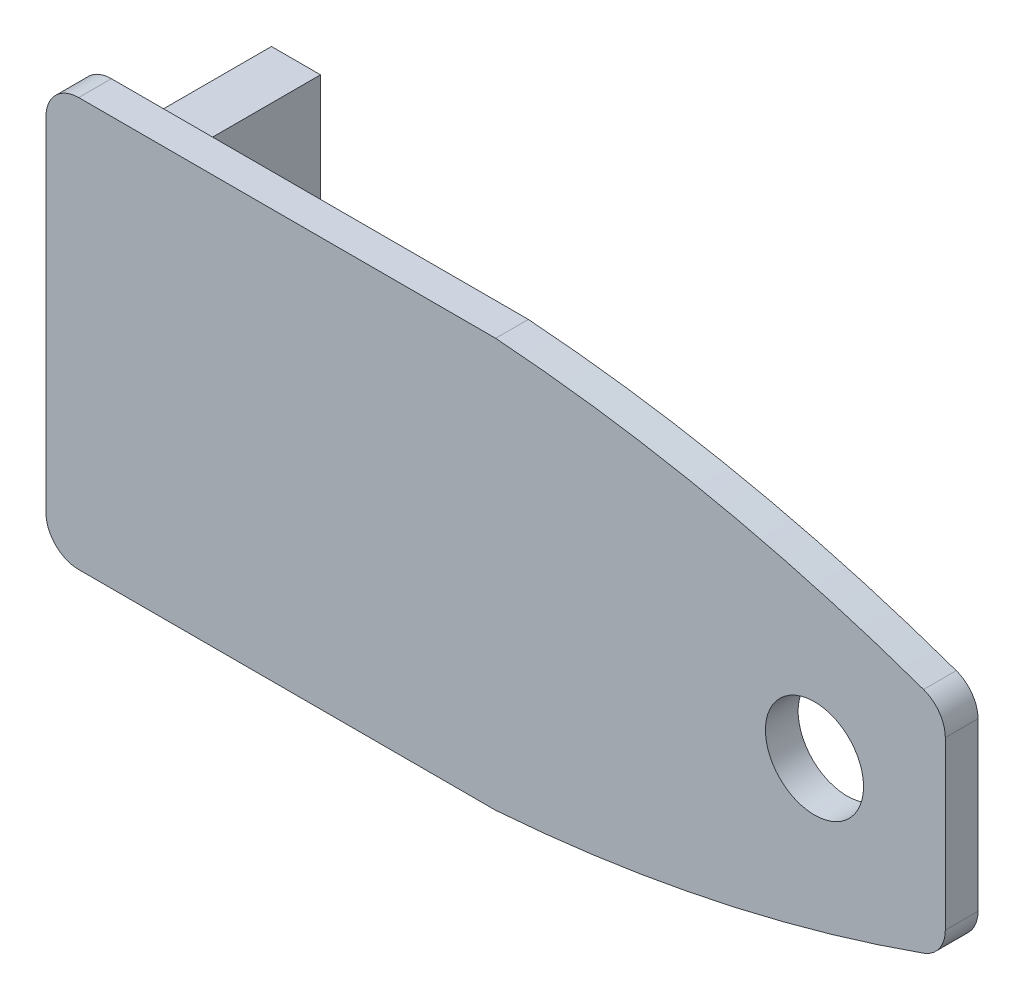
from build123d import *

# Parameters (mm, degrees)
SKETCH1_W           = 69.85
SKETCH1_H           = 31.75
BOSS_EXTRUDE1_DEPTH = 2.54
SKETCH2_W           = 3.81
SKETCH2_H           = 29.21
BOSS_EXTRUDE2_DEPTH = 9.652
SKETCH3_R           = 5.08
CUT_EXTRUDE1_DEPTH  = 10.16
CUT_EXTRUDE2_DEPTH  = 10.16
FILLET1_R           = 2.54
FILLET2_R           = 2.54
SKETCH11_R          = 3.81
CUT_EXTRUDE3_DEPTH  = 10.16


with BuildPart() as part:
    # Sketch1 → Boss-Extrude1 (new body)
    with BuildSketch(Plane.XY):
        Rectangle(SKETCH1_W, SKETCH1_H)
    extrude(amount=BOSS_EXTRUDE1_DEPTH)

    # Sketch2 → Boss-Extrude2 (add)
    with BuildSketch(Plane(origin=(0, 0, 0), x_dir=(-1, 0, 0), z_dir=(0, 0, -1))):
        with Locations((27.700292401, 0)):
            Rectangle(SKETCH2_W, SKETCH2_H)
    extrude(amount=BOSS_EXTRUDE2_DEPTH)

    # Sketch3 → Cut-Extrude1 (cut)
    with BuildSketch(Plane(origin=(-25.795292401, 0, 0), x_dir=(0, 0, -1), z_dir=(1, 0, 0))):
        with Locations((9.652, 0)):
            Circle(SKETCH3_R)
    extrude(amount=-CUT_EXTRUDE1_DEPTH, mode=Mode.SUBTRACT)

    # Sketch9 → Cut-Extrude2 (cut)
    with BuildSketch(Plane.XY.offset(2.54)):
        with BuildLine():
            Line((0, 15.875), (34.925, 15.875))
            Line((34.925, 15.875), (34.925, 8.255))
            ThreePointArc((34.925, 8.255), (17.731940388, 13.29993511), (0, 15.875))
        make_face()
        with BuildLine():
            Line((0, -15.875), (34.925, -15.875))
            Line((34.925, -15.875), (34.925, -8.255))
            ThreePointArc((34.925, -8.255), (17.731940388, -13.29993511), (0, -15.875))
        make_face()
    extrude(amount=-CUT_EXTRUDE2_DEPTH, mode=Mode.SUBTRACT)

    # Fillet1
    fillet1_edges = [part.edges().sort_by_distance(p)[0] for p in [
        (-34.925, 15.875, 1.27),
        (-34.925, -15.875, 1.27),
    ]]
    fillet(fillet1_edges, radius=FILLET1_R)

    # Fillet2
    fillet2_edges = [part.edges().sort_by_distance(p)[0] for p in [
        (34.925, 8.255, 1.27),
        (34.925, -8.255, 1.27),
    ]]
    fillet(fillet2_edges, radius=FILLET2_R)

    # Sketch11 → Cut-Extrude3 (cut)
    with BuildSketch(Plane.XY.offset(2.54)):
        with Locations((24.765, 0)):
            Circle(SKETCH11_R)
    extrude(amount=-CUT_EXTRUDE3_DEPTH, mode=Mode.SUBTRACT)


solid = part.part
